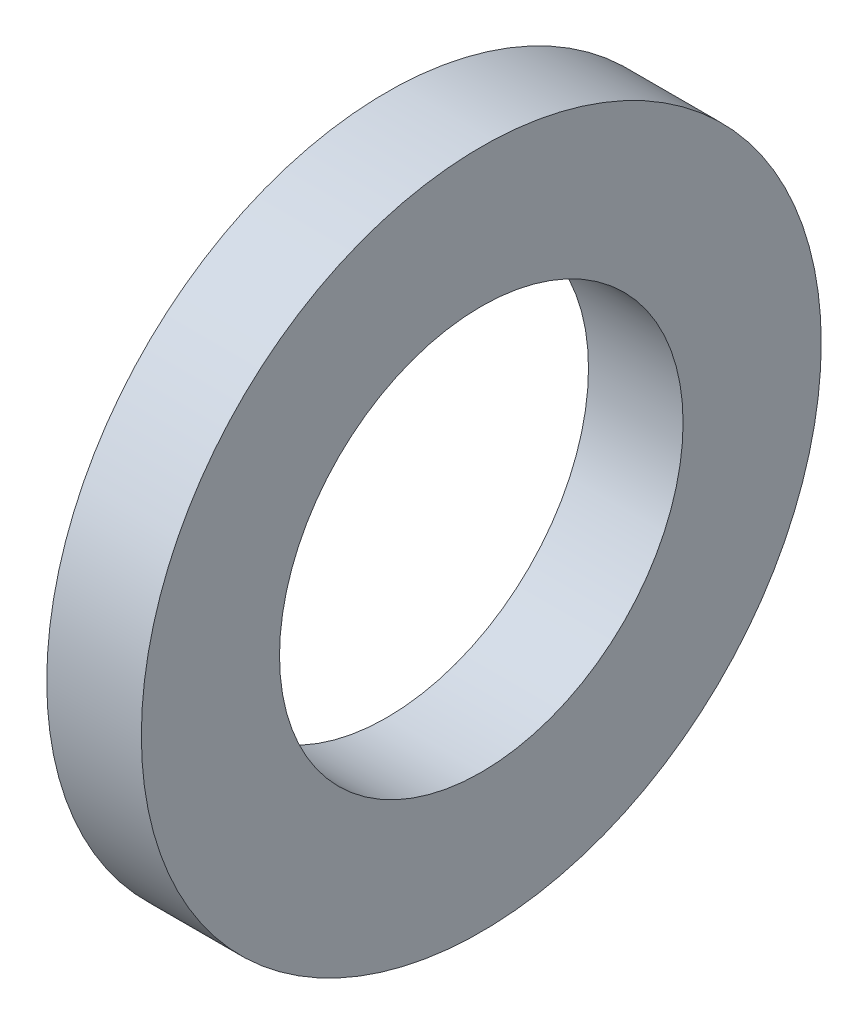
from build123d import *

# Parameters (mm, degrees)
SKETCH1_R           = 46
SKETCH1_R_2         = 27.305
BOSS_EXTRUDE1_DEPTH = 12.8


with BuildPart() as part:
    # Sketch1 → Boss-Extrude1 (new body)
    with BuildSketch(Plane(origin=(0, 0, 0), x_dir=(0, 0, -1), z_dir=(1, 0, 0))):
        Circle(SKETCH1_R)
        Circle(SKETCH1_R_2, mode=Mode.SUBTRACT)
    extrude(amount=BOSS_EXTRUDE1_DEPTH)


solid = part.part
